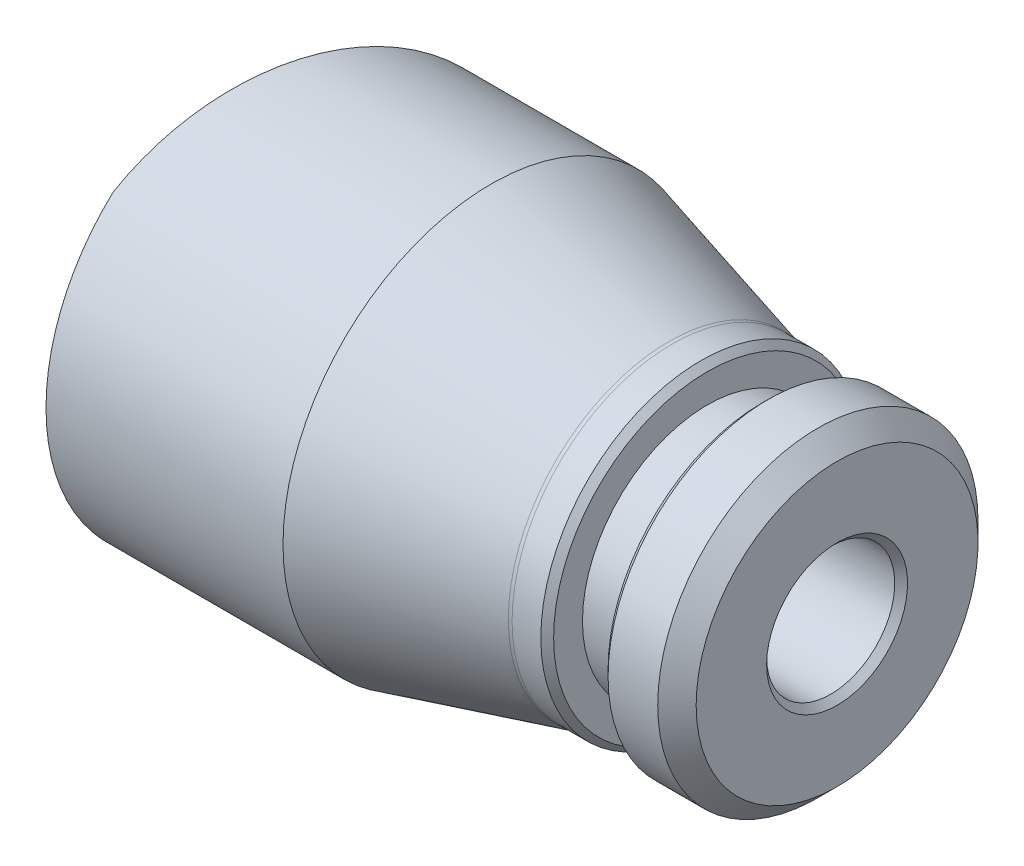
from build123d import *

# Parameters (mm, degrees)
CUT_EXTRUDE_12_DEPTH      = 102.948516419
CUT_EXTRUDE_12_DEPTH_BACK = 102.948516419


with BuildPart() as part:
    # Эскиз1 → Revolve 236 (revolve)
    with BuildSketch(Plane.XY, mode=Mode.PRIVATE) as revolve_236_sk:
        with BuildLine():
            Line((0, 32.5), (37, 32.5))
            Line((37, 32.5), (64.745695, 25.068113))
            ThreePointArc((64.745695, 25.068113), (65.002224223, 25.017098236), (65.263217049, 24.999995817))
            Line((65.263217049, 24.999995817), (69.749999449, 24.999995817))
            Line((69.749999449, 24.999995817), (70.749999449, 23.999995817))
            Line((70.749999449, 23.999995817), (70.749999449, 19.499995817))
            Line((70.749999449, 19.499995817), (79.25, 19.499995817))
            Line((79.25, 19.499995817), (79.25, 24))
            Line((79.25, 24), (80.25, 25))
            Line((80.25, 25), (88, 25))
            Line((88, 25), (91, 22))
            Line((91, 22), (91, 11))
            Line((91, 11), (90, 10))
            Line((90, 10), (61, 10))
            Line((61, 10), (61, 19))
            ThreePointArc((61, 19), (60.707106781, 19.707106781), (60, 20))
            Line((60, 20), (25, 20))
            Line((25, 20), (25, 27.1))
            ThreePointArc((25, 27.1), (24.882842712, 27.382842712), (24.6, 27.5))
            Line((24.6, 27.5), (0, 27.5))
            Line((0, 27.5), (0, 32.5))
        make_face()
    revolve(revolve_236_sk.sketch.rotate(Axis((0, 0, 0), (1, 0, 0)), 90), axis=Axis((0, 0, 0), (1, 0, 0)))

    # Эскиз2 → Наклон торца 12 градусов (cut, two sides: drawn at the far end of the back side and taken through both)
    with BuildSketch(Plane(origin=(0, 0, 0), x_dir=(1, 0, 0), z_dir=(0, 1, 0)).offset(-CUT_EXTRUDE_12_DEPTH_BACK)):
        Polygon((-25, 50), (15.30407244, 50), (-5.951583727, -50), (-25, -50), align=None)
    extrude(amount=CUT_EXTRUDE_12_DEPTH + CUT_EXTRUDE_12_DEPTH_BACK, mode=Mode.SUBTRACT)


solid = part.part
